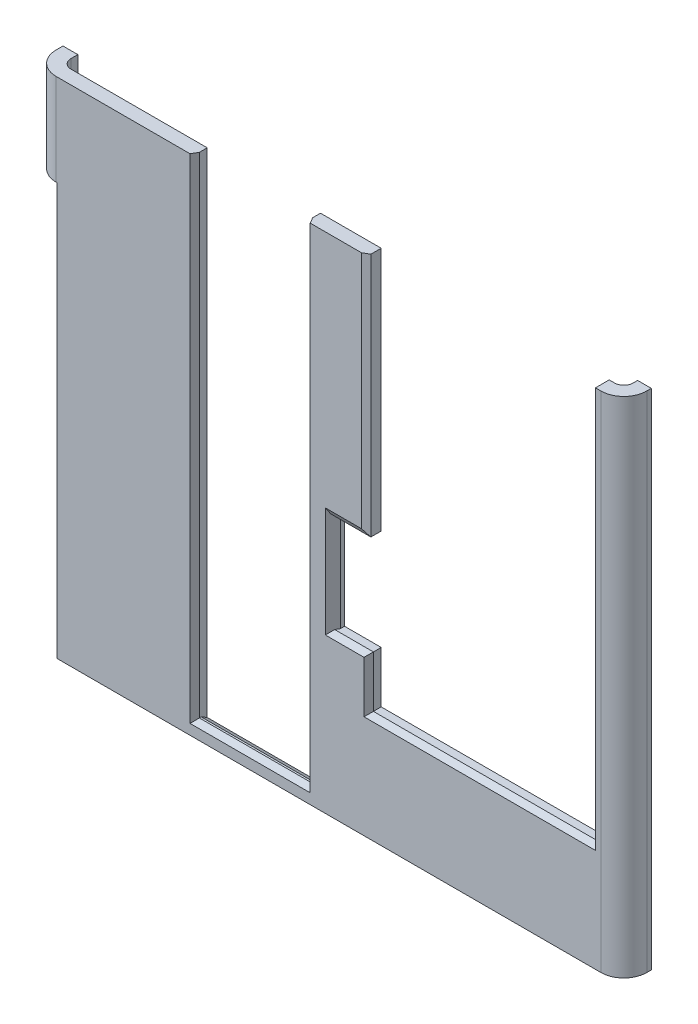
from build123d import *
from OCP.BRepFilletAPI import BRepFilletAPI_MakeChamfer

# Parameters (mm, degrees)
SKETCH1_W           = 121
SKETCH1_H           = 110
BOSS_EXTRUDE1_DEPTH = 3
SKETCH8_W           = 3
SKETCH8_H           = 110
BOSS_EXTRUDE5_DEPTH = 3
FILLET4_R           = 2
FILLET5_R           = 5
SKETCH9_W           = 1
SKETCH9_H           = 110
BOSS_EXTRUDE6_DEPTH = 2.5
BOSS_EXTRUDE7_DEPTH = 110
SKETCH11_W          = 24.75
SKETCH11_H          = 107
SKETCH11_W_2        = 49.8
SKETCH11_H_2        = 86.75
CUT_EXTRUDE1_DEPTH  = 3
CHAMFER1_SIZE       = 0.75
CHAMFER1_SIZE2      = 1.299038106
CHAMFER2_SIZE       = 0.75
CHAMFER2_SIZE2      = 1.299038106
SKETCH13_W          = 8
SKETCH13_H          = 22
CUT_EXTRUDE4_DEPTH  = 3
CHAMFER3_SIZE       = 0.75
CHAMFER3_SIZE2      = 1.299038106
CHAMFER4_SIZE       = 1.2
CHAMFER4_SIZE2      = 2.078460969
SKETCH14_W          = 3
SKETCH14_H          = 110
BOSS_EXTRUDE8_DEPTH = 8
SKETCH15_W          = 3.25
SKETCH15_H          = 110
BOSS_EXTRUDE9_DEPTH = 3.5
FILLET6_R           = 2
FILLET7_R           = 5
CUT_EXTRUDE5_START  = -6.5
SKETCH17_W          = 5.25
SKETCH17_H          = 90
CUT_EXTRUDE5_DEPTH  = 6.5
SKETCH18_W          = 3
SKETCH18_H          = 5.101072491
CUT_EXTRUDE6_DEPTH  = 110


with BuildPart() as part:
    # Sketch1 → Boss-Extrude1 (new body)
    with BuildSketch(Plane.XY):
        Rectangle(SKETCH1_W, SKETCH1_H)
    extrude(amount=BOSS_EXTRUDE1_DEPTH)

    # Sketch8 → Boss-Extrude5 (add)
    with BuildSketch(Plane(origin=(0, 0, 0), x_dir=(-1, 0, 0), z_dir=(0, 0, -1))):
        with Locations((-59, 0)):
            Rectangle(SKETCH8_W, SKETCH8_H)
    extrude(amount=BOSS_EXTRUDE5_DEPTH)

    # Fillet4
    fillet4_edges = [part.edges().sort_by_distance(p)[0] for p in [
        (57.5, 0, 0),
    ]]
    fillet(fillet4_edges, radius=FILLET4_R)

    # Fillet5
    fillet5_edges = [part.edges().sort_by_distance(p)[0] for p in [
        (60.5, 0, 3),
    ]]
    fillet(fillet5_edges, radius=FILLET5_R)

    # Sketch9 → Boss-Extrude6 (add)
    with BuildSketch(Plane(origin=(0, 0, -3), x_dir=(-1, 0, 0), z_dir=(0, 0, -1))):
        with Locations((-59, 0)):
            Rectangle(SKETCH9_W, SKETCH9_H)
    extrude(amount=BOSS_EXTRUDE6_DEPTH)

    # Sketch10 → Boss-Extrude7 (add, through all)
    with BuildSketch(Plane(origin=(0, 55, 0), x_dir=(1, 0, 0), z_dir=(0, 1, 0))):
        Polygon((58.5, 5.5), (58, 3), (58.5, 3), align=None)
    extrude(amount=-BOSS_EXTRUDE7_DEPTH)

    # Sketch11 → Cut-Extrude1 (cut)
    with BuildSketch(Plane.XY.offset(3)):
        with Locations((-21.125, 1.5)):
            Rectangle(SKETCH11_W, SKETCH11_H)
        with Locations((29.4, 11.625)):
            Rectangle(SKETCH11_W_2, SKETCH11_H_2)
    extrude(amount=-CUT_EXTRUDE1_DEPTH, mode=Mode.SUBTRACT)

    # Chamfer1
    chamfer1_edges = [part.edges().sort_by_distance(p)[0] for p in [
        (-33.5, 1.5, 3),
        (-21.125, -52, 3),
        (-8.75, 1.5, 3),
    ]]
    chamfer1_side = [part.faces().sort_by_distance(p)[0] for p in [
        (-58.901375591, 0, 3),
    ]]
    chamfer(chamfer1_edges, length=CHAMFER1_SIZE, length2=CHAMFER1_SIZE2, reference=chamfer1_side[0])

    # Chamfer2
    chamfer2_edges = [part.edges().sort_by_distance(p)[0] for p in [
        (-21.125, -52, 0),
    ]]
    chamfer2_side = [part.faces().sort_by_distance(p)[0] for p in [
        (55.340137559, 0, 0),
    ]]
    chamfer(chamfer2_edges, length=CHAMFER2_SIZE, length2=CHAMFER2_SIZE2, reference=chamfer2_side[0])

    # Sketch13 → Cut-Extrude4 (cut)
    with BuildSketch(Plane.XY.offset(3)):
        with Locations((0.5, -9.5)):
            Rectangle(SKETCH13_W, SKETCH13_H)
    extrude(amount=-CUT_EXTRUDE4_DEPTH, mode=Mode.SUBTRACT)

    # Chamfer3: one chamfer whose edges measure the first distance from different faces: ONE call of the kernel's chamfer builder (chamfer() names one face for all edges)
    chamfer3_edges_1 = [part.edges().sort_by_distance(p)[0] for p in [
        (4.5, -26.125, 3),
        (0.5, -20.5, 3),
        (29.4, -31.75, 3),
    ]]
    chamfer3_side_1 = [part.faces().sort_by_distance(p)[0] for p in [
        (-6.401375591, 1.125, 3),
    ]]
    chamfer3_edges_2 = [part.edges().sort_by_distance(p)[0] for p in [
        (0.5, 1.5, 3),
    ]]
    chamfer3_side_2 = [part.faces().sort_by_distance(p)[0] for p in [
        (0.5, 1.5, 1.5),
    ]]
    chamfer3_edges_3 = [part.edges().sort_by_distance(p)[0] for p in [
        (4.5, 28.25, 3),
    ]]
    chamfer3_side_3 = [part.faces().sort_by_distance(p)[0] for p in [
        (4.5, 28.25, 1.5),
    ]]
    chamfer3 = BRepFilletAPI_MakeChamfer(part.part.solid().wrapped)
    for e in chamfer3_edges_1:
        chamfer3.Add(CHAMFER3_SIZE, CHAMFER3_SIZE2, e.wrapped, chamfer3_side_1[0].wrapped)  # the first distance lies on this face
    for e in chamfer3_edges_2:
        chamfer3.Add(CHAMFER3_SIZE, CHAMFER3_SIZE2, e.wrapped, chamfer3_side_2[0].wrapped)  # the first distance lies on this face
    for e in chamfer3_edges_3:
        chamfer3.Add(CHAMFER3_SIZE, CHAMFER3_SIZE2, e.wrapped, chamfer3_side_3[0].wrapped)  # the first distance lies on this face
    add(Compound.cast(chamfer3.Shape()), mode=Mode.REPLACE)

    # Chamfer4
    chamfer4_edges = [part.edges().sort_by_distance(p)[0] for p in [
        (-3.5, -9.225480947, 3),
    ]]
    chamfer4_side = [part.faces().sort_by_distance(p)[0] for p in [
        (-2.399519053, 53.401375591, 3),
    ]]
    chamfer(chamfer4_edges, length=CHAMFER4_SIZE, length2=CHAMFER4_SIZE2, reference=chamfer4_side[0])

    # Sketch14 → Boss-Extrude8 (add)
    with BuildSketch(Plane.ZY.offset(60.5)):
        with Locations((1.5, 0)):
            Rectangle(SKETCH14_W, SKETCH14_H)
    extrude(amount=BOSS_EXTRUDE8_DEPTH)

    # Sketch15 → Boss-Extrude9 (add)
    with BuildSketch(Plane(origin=(0, 0, 0), x_dir=(-1, 0, 0), z_dir=(0, 0, -1))):
        with Locations((66.875, 0)):
            Rectangle(SKETCH15_W, SKETCH15_H)
    extrude(amount=BOSS_EXTRUDE9_DEPTH)

    # Fillet6
    fillet6_edges = [part.edges().sort_by_distance(p)[0] for p in [
        (-65.25, 0, 0),
    ]]
    fillet(fillet6_edges, radius=FILLET6_R)

    # Fillet7
    fillet7_edges = [part.edges().sort_by_distance(p)[0] for p in [
        (-68.5, 0, 3),
    ]]
    fillet(fillet7_edges, radius=FILLET7_R)

    # Sketch17 → Cut-Extrude5 (cut)
    with BuildSketch(Plane(origin=(0, 0, -3.5), x_dir=(-1, 0, 0), z_dir=(0, 0, -1)).offset(CUT_EXTRUDE5_START)):
        with Locations((65.875, -10)):
            Rectangle(SKETCH17_W, SKETCH17_H)
    extrude(amount=CUT_EXTRUDE5_DEPTH, mode=Mode.SUBTRACT)

    # Sketch18 → Cut-Extrude6 (cut)
    with BuildSketch(Plane(origin=(0, 55, 0), x_dir=(1, 0, 0), z_dir=(0, 1, 0))):
        with Locations((59, 5.550536246)):
            Rectangle(SKETCH18_W, SKETCH18_H)
    extrude(amount=-CUT_EXTRUDE6_DEPTH, mode=Mode.SUBTRACT)


solid = part.part
